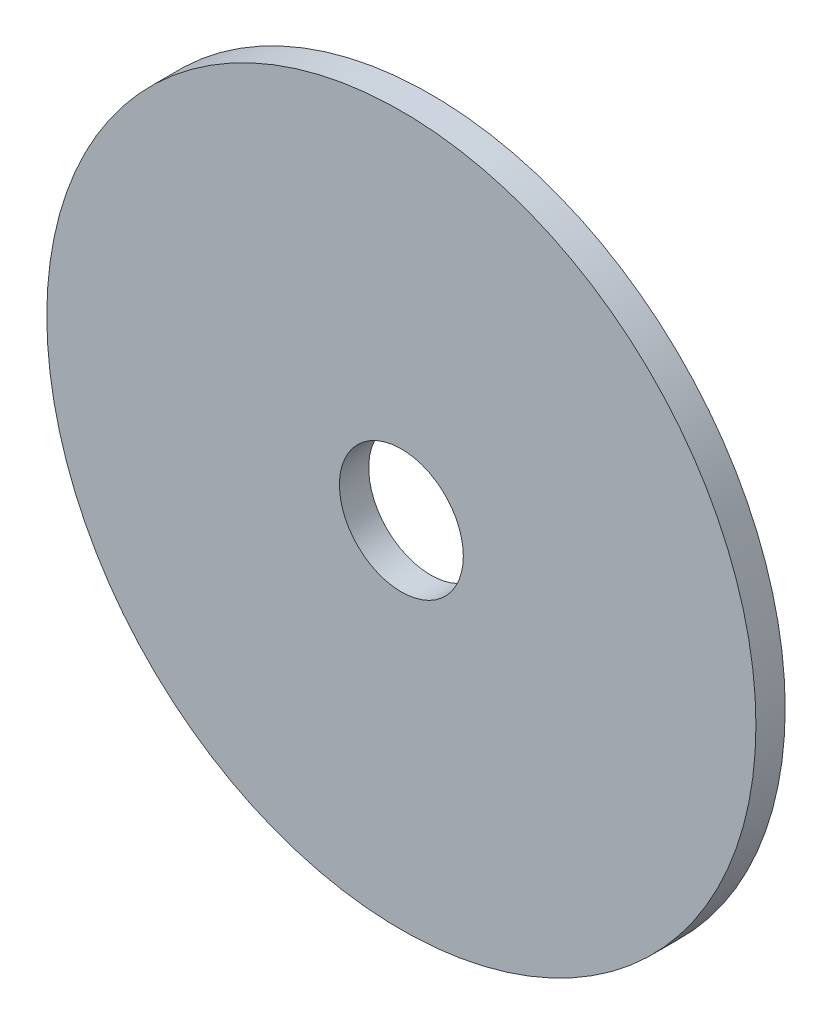
from build123d import *

# Parameters (mm, degrees)
SKETCH1_R           = 18.175
SKETCH1_R_2         = 3.175
BOSS_EXTRUDE1_DEPTH = 1.5


with BuildPart() as part:
    # Sketch1 → Boss-Extrude1 (new body)
    with BuildSketch(Plane.XY):
        with Locations((-5.065195061, 3.509456578)):
            Circle(SKETCH1_R)
        with Locations((-5.065195061, 3.509456578)):
            Circle(SKETCH1_R_2, mode=Mode.SUBTRACT)
    extrude(amount=BOSS_EXTRUDE1_DEPTH)


solid = part.part
